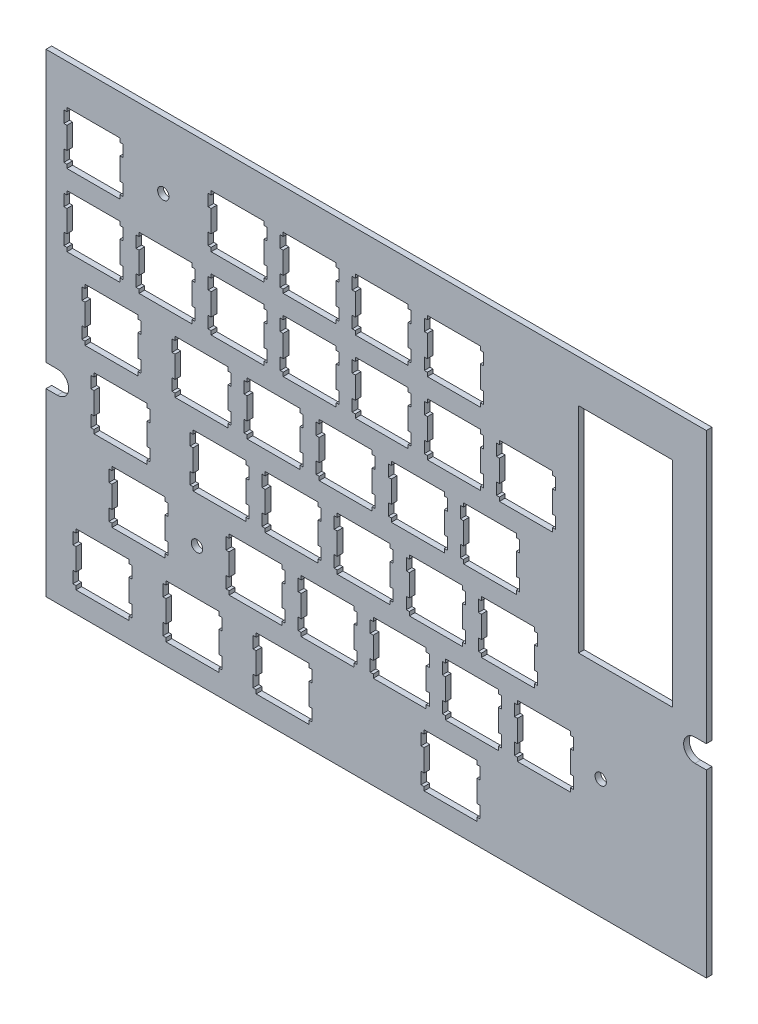
from build123d import *

# Parameters (mm, degrees)
MODEL_R         = 1.5
MODEL_W         = 24.78
MODEL_H         = 56.609226212
EXTRUDE_1_DEPTH = 1.5


with BuildPart() as part:
    # Model → 凸台-拉伸1 (new body)
    with BuildSketch(Plane.XY):
        with BuildLine():
            Line((511.599563197, 91.356049899), (337.097647797, 91.356049899))
            Line((337.097647797, 91.356049899), (337.097647797, 138.982456899))
            Line((337.097647797, 138.982456899), (340.097647797, 138.982456899))
            ThreePointArc((340.097647797, 138.982456899), (343.097647797, 141.982456899), (340.097647797, 144.982456899))
            Line((340.097647797, 144.982456899), (337.097647797, 144.982456899))
            Line((337.097647797, 144.982456899), (337.097647797, 216.656356899))
            Line((337.097647797, 216.656356899), (511.599563197, 216.656356899))
            Line((511.599563197, 216.656356899), (511.599563197, 144.981756899))
            Line((511.599563197, 144.981756899), (508.599563197, 144.981756899))
            ThreePointArc((508.599563197, 144.981756899), (505.599563197, 141.981756899), (508.599563197, 138.981756899))
            Line((508.599563197, 138.981756899), (511.599563197, 138.981756899))
            Line((511.599563197, 138.981756899), (511.599563197, 91.356049899))
        make_face()
        with Locations((368.097647797, 199.131356899)):
            Circle(MODEL_R, mode=Mode.SUBTRACT)
        with Locations((377.006250697, 122.931656899)):
            Circle(MODEL_R, mode=Mode.SUBTRACT)
        with Locations((483.684563197, 122.931656899)):
            Circle(MODEL_R, mode=Mode.SUBTRACT)
        Polygon((392.628563197, 110.882856899), (392.628563197, 109.882456899), (391.827763197, 109.882456899), (391.827763197, 106.783156899), (392.628563197, 106.783156899), (392.628563197, 100.981646899), (391.827763197, 100.981646899), (391.827763197, 97.882466899), (392.628563197, 97.882466899), (392.628563197, 96.881996899), (406.627863197, 96.881996899), (406.627863197, 97.882466899), (407.428663197, 97.882466899), (407.428663197, 100.981646899), (406.627863197, 100.981646899), (406.627863197, 106.783156899), (407.428663197, 106.783156899), (407.428663197, 109.882456899), (406.627863197, 109.882456899), (406.627863197, 110.882856899), align=None, mode=Mode.SUBTRACT)
        Polygon((368.814563197, 110.882856899), (368.814563197, 109.882456899), (368.015363197, 109.882456899), (368.015363197, 106.783156899), (368.814563197, 106.783156899), (368.814563197, 100.981646899), (368.015363197, 100.981646899), (368.015363197, 97.882466899), (368.814563197, 97.882466899), (368.814563197, 96.881996899), (382.815363197, 96.881996899), (382.815363197, 97.882466899), (383.614763197, 97.882466899), (383.614763197, 100.981646899), (382.815363197, 100.981646899), (382.815363197, 106.783156899), (383.614763197, 106.783156899), (383.614763197, 109.882456899), (382.815363197, 109.882456899), (382.815363197, 110.882856899), align=None, mode=Mode.SUBTRACT)
        Polygon((345.003473197, 110.882856899), (345.003473197, 109.882456899), (344.202843197, 109.882456899), (344.202843197, 106.783156899), (345.003473197, 106.783156899), (345.003473197, 100.981646899), (344.202843197, 100.981646899), (344.202843197, 97.882466899), (345.003473197, 97.882466899), (345.003473197, 96.881996899), (359.002963197, 96.881996899), (359.002963197, 97.882466899), (359.803563197, 97.882466899), (359.803563197, 100.981646899), (359.002963197, 100.981646899), (359.002963197, 106.783156899), (359.803563197, 106.783156899), (359.803563197, 109.882456899), (359.002963197, 109.882456899), (359.002963197, 110.882856899), align=None, mode=Mode.SUBTRACT)
        Polygon((461.684563197, 129.931356899), (461.684563197, 128.931056899), (460.883563197, 128.931056899), (460.883563197, 125.833156899), (461.684563197, 125.833156899), (461.684563197, 120.031656899), (460.883563197, 120.031656899), (460.883563197, 116.931056899), (461.684563197, 116.931056899), (461.684563197, 115.931956899), (475.684563197, 115.931956899), (475.684563197, 116.931056899), (476.483563197, 116.931056899), (476.483563197, 120.031656899), (475.684563197, 120.031656899), (475.684563197, 125.833156899), (476.483563197, 125.833156899), (476.483563197, 128.931056899), (475.684563197, 128.931056899), (475.684563197, 129.931356899), align=None, mode=Mode.SUBTRACT)
        Polygon((442.634563197, 129.931356899), (442.634563197, 128.931056899), (441.833563197, 128.931056899), (441.833563197, 125.833156899), (442.634563197, 125.833156899), (442.634563197, 120.031656899), (441.833563197, 120.031656899), (441.833563197, 116.931056899), (442.634563197, 116.931056899), (442.634563197, 115.931956899), (456.634563197, 115.931956899), (456.634563197, 116.931056899), (457.433563197, 116.931056899), (457.433563197, 120.031656899), (456.634563197, 120.031656899), (456.634563197, 125.833156899), (457.433563197, 125.833156899), (457.433563197, 128.931056899), (456.634563197, 128.931056899), (456.634563197, 129.931356899), align=None, mode=Mode.SUBTRACT)
        Polygon((423.584763197, 129.931356899), (423.584763197, 128.931056899), (422.783963197, 128.931056899), (422.783963197, 125.833156899), (423.584763197, 125.833156899), (423.584763197, 120.031656899), (422.783963197, 120.031656899), (422.783963197, 116.931056899), (423.584763197, 116.931056899), (423.584763197, 115.931956899), (437.584063197, 115.931956899), (437.584063197, 116.931056899), (438.383463197, 116.931056899), (438.383463197, 120.031656899), (437.584063197, 120.031656899), (437.584063197, 125.833156899), (438.383463197, 125.833156899), (438.383463197, 128.931056899), (437.584063197, 128.931056899), (437.584063197, 129.931356899), align=None, mode=Mode.SUBTRACT)
        Polygon((404.534763197, 129.931356899), (404.534763197, 128.931056899), (403.733963197, 128.931056899), (403.733963197, 125.833156899), (404.534763197, 125.833156899), (404.534763197, 120.031656899), (403.733963197, 120.031656899), (403.733963197, 116.931056899), (404.534763197, 116.931056899), (404.534763197, 115.931956899), (418.534063197, 115.931956899), (418.534063197, 116.931056899), (419.333463197, 116.931056899), (419.333463197, 120.031656899), (418.534063197, 120.031656899), (418.534063197, 125.833156899), (419.333463197, 125.833156899), (419.333463197, 128.931056899), (418.534063197, 128.931056899), (418.534063197, 129.931356899), align=None, mode=Mode.SUBTRACT)
        Polygon((385.484763197, 129.931356899), (385.484763197, 128.931056899), (384.683963197, 128.931056899), (384.683963197, 125.833156899), (385.484763197, 125.833156899), (385.484763197, 120.031656899), (384.683963197, 120.031656899), (384.683963197, 116.931056899), (385.484763197, 116.931056899), (385.484763197, 115.931956899), (399.484063197, 115.931956899), (399.484063197, 116.931056899), (400.283463197, 116.931056899), (400.283463197, 120.031656899), (399.484063197, 120.031656899), (399.484063197, 125.833156899), (400.283463197, 125.833156899), (400.283463197, 128.931056899), (399.484063197, 128.931056899), (399.484063197, 129.931356899), align=None, mode=Mode.SUBTRACT)
        Polygon((452.159563197, 148.981456899), (452.159563197, 147.980956899), (451.358563197, 147.980956899), (451.358563197, 144.883156899), (452.159563197, 144.883156899), (452.159563197, 139.081756899), (451.358563197, 139.081756899), (451.358563197, 135.981156899), (452.159563197, 135.981156899), (452.159563197, 134.982156899), (466.159563197, 134.982156899), (466.159563197, 135.981156899), (466.958563197, 135.981156899), (466.958563197, 139.081756899), (466.159563197, 139.081756899), (466.159563197, 144.883156899), (466.958563197, 144.883156899), (466.958563197, 147.980956899), (466.159563197, 147.980956899), (466.159563197, 148.981456899), align=None, mode=Mode.SUBTRACT)
        Polygon((433.109763197, 148.981456899), (433.109763197, 147.980956899), (432.308963197, 147.980956899), (432.308963197, 144.883156899), (433.109763197, 144.883156899), (433.109763197, 139.081756899), (432.308963197, 139.081756899), (432.308963197, 135.981156899), (433.109763197, 135.981156899), (433.109763197, 134.982156899), (447.109563197, 134.982156899), (447.109563197, 135.981156899), (447.908563197, 135.981156899), (447.908563197, 139.081756899), (447.109563197, 139.081756899), (447.109563197, 144.883156899), (447.908563197, 144.883156899), (447.908563197, 147.980956899), (447.109563197, 147.980956899), (447.109563197, 148.981456899), align=None, mode=Mode.SUBTRACT)
        Polygon((414.059763197, 148.981456899), (414.059763197, 147.980956899), (413.258963197, 147.980956899), (413.258963197, 144.883156899), (414.059763197, 144.883156899), (414.059763197, 139.081756899), (413.258963197, 139.081756899), (413.258963197, 135.981156899), (414.059763197, 135.981156899), (414.059763197, 134.982156899), (428.059063197, 134.982156899), (428.059063197, 135.981156899), (428.858463197, 135.981156899), (428.858463197, 139.081756899), (428.059063197, 139.081756899), (428.059063197, 144.883156899), (428.858463197, 144.883156899), (428.858463197, 147.980956899), (428.059063197, 147.980956899), (428.059063197, 148.981456899), align=None, mode=Mode.SUBTRACT)
        Polygon((395.009763197, 148.981456899), (395.009763197, 147.980956899), (394.208963197, 147.980956899), (394.208963197, 144.883156899), (395.009763197, 144.883156899), (395.009763197, 139.081756899), (394.208963197, 139.081756899), (394.208963197, 135.981156899), (395.009763197, 135.981156899), (395.009763197, 134.982156899), (409.009063197, 134.982156899), (409.009063197, 135.981156899), (409.808463197, 135.981156899), (409.808463197, 139.081756899), (409.009063197, 139.081756899), (409.009063197, 144.883156899), (409.808463197, 144.883156899), (409.808463197, 147.980956899), (409.009063197, 147.980956899), (409.009063197, 148.981456899), align=None, mode=Mode.SUBTRACT)
        Polygon((375.959763197, 148.981456899), (375.959763197, 147.980956899), (375.159063197, 147.980956899), (375.159063197, 144.883156899), (375.959763197, 144.883156899), (375.959763197, 139.081756899), (375.159063197, 139.081756899), (375.159063197, 135.981156899), (375.959763197, 135.981156899), (375.959763197, 134.982156899), (389.959063197, 134.982156899), (389.959063197, 135.981156899), (390.758463197, 135.981156899), (390.758463197, 139.081756899), (389.959063197, 139.081756899), (389.959063197, 144.883156899), (390.758463197, 144.883156899), (390.758463197, 147.980956899), (389.959063197, 147.980956899), (389.959063197, 148.981456899), align=None, mode=Mode.SUBTRACT)
        Polygon((349.764593197, 148.981456899), (349.764593197, 147.980956899), (348.965343197, 147.980956899), (348.965343197, 144.883156899), (349.764593197, 144.883156899), (349.764593197, 139.081756899), (348.965343197, 139.081756899), (348.965343197, 135.981156899), (349.764593197, 135.981156899), (349.764593197, 134.982156899), (363.765463197, 134.982156899), (363.765463197, 135.981156899), (364.564763197, 135.981156899), (364.564763197, 139.081756899), (363.765463197, 139.081756899), (363.765463197, 144.883156899), (364.564763197, 144.883156899), (364.564763197, 147.980956899), (363.765463197, 147.980956899), (363.765463197, 148.981456899), align=None, mode=Mode.SUBTRACT)
        Polygon((447.397563197, 168.031456899), (447.397563197, 167.030956899), (446.596563197, 167.030956899), (446.596563197, 163.931756899), (447.397563197, 163.931756899), (447.397563197, 158.131756899), (446.596563197, 158.131756899), (446.596563197, 155.031156899), (447.397563197, 155.031156899), (447.397563197, 154.032156899), (461.396563197, 154.032156899), (461.396563197, 155.031156899), (462.197563197, 155.031156899), (462.197563197, 158.131756899), (461.396563197, 158.131756899), (461.396563197, 163.931756899), (462.197563197, 163.931756899), (462.197563197, 167.030956899), (461.396563197, 167.030956899), (461.396563197, 168.031456899), align=None, mode=Mode.SUBTRACT)
        Polygon((428.347263197, 168.031456899), (428.347263197, 167.030956899), (427.546463197, 167.030956899), (427.546463197, 163.931756899), (428.347263197, 163.931756899), (428.347263197, 158.131756899), (427.546463197, 158.131756899), (427.546463197, 155.031156899), (428.347263197, 155.031156899), (428.347263197, 154.032156899), (442.346563197, 154.032156899), (442.346563197, 155.031156899), (443.147563197, 155.031156899), (443.147563197, 158.131756899), (442.346563197, 158.131756899), (442.346563197, 163.931756899), (443.147563197, 163.931756899), (443.147563197, 167.030956899), (442.346563197, 167.030956899), (442.346563197, 168.031456899), align=None, mode=Mode.SUBTRACT)
        Polygon((409.297263197, 168.031456899), (409.297263197, 167.030956899), (408.496463197, 167.030956899), (408.496463197, 163.931756899), (409.297263197, 163.931756899), (409.297263197, 158.131756899), (408.496463197, 158.131756899), (408.496463197, 155.031156899), (409.297263197, 155.031156899), (409.297263197, 154.032156899), (423.296563197, 154.032156899), (423.296563197, 155.031156899), (424.097363197, 155.031156899), (424.097363197, 158.131756899), (423.296563197, 158.131756899), (423.296563197, 163.931756899), (424.097363197, 163.931756899), (424.097363197, 167.030956899), (423.296563197, 167.030956899), (423.296563197, 168.031456899), align=None, mode=Mode.SUBTRACT)
        Polygon((390.247263197, 168.031456899), (390.247263197, 167.030956899), (389.446463197, 167.030956899), (389.446463197, 163.931756899), (390.247263197, 163.931756899), (390.247263197, 158.131756899), (389.446463197, 158.131756899), (389.446463197, 155.031156899), (390.247263197, 155.031156899), (390.247263197, 154.032156899), (404.246563197, 154.032156899), (404.246563197, 155.031156899), (405.047363197, 155.031156899), (405.047363197, 158.131756899), (404.246563197, 158.131756899), (404.246563197, 163.931756899), (405.047363197, 163.931756899), (405.047363197, 167.030956899), (404.246563197, 167.030956899), (404.246563197, 168.031456899), align=None, mode=Mode.SUBTRACT)
        Polygon((371.197263197, 168.031456899), (371.197263197, 167.030956899), (370.396563197, 167.030956899), (370.396563197, 163.931756899), (371.197263197, 163.931756899), (371.197263197, 158.131756899), (370.396563197, 158.131756899), (370.396563197, 155.031156899), (371.197263197, 155.031156899), (371.197263197, 154.032156899), (385.196563197, 154.032156899), (385.196563197, 155.031156899), (385.997363197, 155.031156899), (385.997363197, 158.131756899), (385.196563197, 158.131756899), (385.196563197, 163.931756899), (385.997363197, 163.931756899), (385.997363197, 167.030956899), (385.196563197, 167.030956899), (385.196563197, 168.031456899), align=None, mode=Mode.SUBTRACT)
        Polygon((347.384723197, 168.031456899), (347.384723197, 167.030956899), (346.584093197, 167.030956899), (346.584093197, 163.931756899), (347.384723197, 163.931756899), (347.384723197, 158.131756899), (346.584093197, 158.131756899), (346.584093197, 155.031156899), (347.384723197, 155.031156899), (347.384723197, 154.032156899), (361.384263197, 154.032156899), (361.384263197, 155.031156899), (362.183463197, 155.031156899), (362.183463197, 158.131756899), (361.384263197, 158.131756899), (361.384263197, 163.931756899), (362.183463197, 163.931756899), (362.183463197, 167.030956899), (361.384263197, 167.030956899), (361.384263197, 168.031456899), align=None, mode=Mode.SUBTRACT)
        Polygon((456.920563197, 187.081456899), (456.920563197, 186.080956899), (456.121563197, 186.080956899), (456.121563197, 182.981756899), (456.920563197, 182.981756899), (456.920563197, 177.181756899), (456.121563197, 177.181756899), (456.121563197, 174.081156899), (456.920563197, 174.081156899), (456.920563197, 173.082156899), (470.921563197, 173.082156899), (470.921563197, 174.081156899), (471.722563197, 174.081156899), (471.722563197, 177.181756899), (470.921563197, 177.181756899), (470.921563197, 182.981756899), (471.722563197, 182.981756899), (471.722563197, 186.080956899), (470.921563197, 186.080956899), (470.921563197, 187.081456899), align=None, mode=Mode.SUBTRACT)
        Polygon((437.870863197, 187.081456899), (437.870863197, 186.080956899), (437.071463197, 186.080956899), (437.071463197, 182.981756899), (437.870863197, 182.981756899), (437.870863197, 177.181756899), (437.071463197, 177.181756899), (437.071463197, 174.081156899), (437.870863197, 174.081156899), (437.870863197, 173.082156899), (451.871563197, 173.082156899), (451.871563197, 174.081156899), (452.670563197, 174.081156899), (452.670563197, 177.181756899), (451.871563197, 177.181756899), (451.871563197, 182.981756899), (452.670563197, 182.981756899), (452.670563197, 186.080956899), (451.871563197, 186.080956899), (451.871563197, 187.081456899), align=None, mode=Mode.SUBTRACT)
        Polygon((418.822263197, 187.081456899), (418.822263197, 186.080956899), (418.021463197, 186.080956899), (418.021463197, 182.981756899), (418.822263197, 182.981756899), (418.822263197, 177.181756899), (418.021463197, 177.181756899), (418.021463197, 174.081156899), (418.822263197, 174.081156899), (418.822263197, 173.082156899), (432.821563197, 173.082156899), (432.821563197, 174.081156899), (433.620963197, 174.081156899), (433.620963197, 177.181756899), (432.821563197, 177.181756899), (432.821563197, 182.981756899), (433.620963197, 182.981756899), (433.620963197, 186.080956899), (432.821563197, 186.080956899), (432.821563197, 187.081456899), align=None, mode=Mode.SUBTRACT)
        Polygon((399.772263197, 187.081456899), (399.772263197, 186.080956899), (398.971463197, 186.080956899), (398.971463197, 182.981756899), (399.772263197, 182.981756899), (399.772263197, 177.181756899), (398.971463197, 177.181756899), (398.971463197, 174.081156899), (399.772263197, 174.081156899), (399.772263197, 173.082156899), (413.771563197, 173.082156899), (413.771563197, 174.081156899), (414.572363197, 174.081156899), (414.572363197, 177.181756899), (413.771563197, 177.181756899), (413.771563197, 182.981756899), (414.572363197, 182.981756899), (414.572363197, 186.080956899), (413.771563197, 186.080956899), (413.771563197, 187.081456899), align=None, mode=Mode.SUBTRACT)
        Polygon((380.722263197, 187.081456899), (380.722263197, 186.080956899), (379.921463197, 186.080956899), (379.921463197, 182.981756899), (380.722263197, 182.981756899), (380.722263197, 177.181756899), (379.921463197, 177.181756899), (379.921463197, 174.081156899), (380.722263197, 174.081156899), (380.722263197, 173.082156899), (394.721563197, 173.082156899), (394.721563197, 174.081156899), (395.522363197, 174.081156899), (395.522363197, 177.181756899), (394.721563197, 177.181756899), (394.721563197, 182.981756899), (395.522363197, 182.981756899), (395.522363197, 186.080956899), (394.721563197, 186.080956899), (394.721563197, 187.081456899), align=None, mode=Mode.SUBTRACT)
        Polygon((361.672263197, 187.081456899), (361.672263197, 186.080956899), (360.871563197, 186.080956899), (360.871563197, 182.981756899), (361.672263197, 182.981756899), (361.672263197, 177.181756899), (360.871563197, 177.181756899), (360.871563197, 174.081156899), (361.672263197, 174.081156899), (361.672263197, 173.082156899), (375.671563197, 173.082156899), (375.671563197, 174.081156899), (376.472363197, 174.081156899), (376.472363197, 177.181756899), (375.671563197, 177.181756899), (375.671563197, 182.981756899), (376.472363197, 182.981756899), (376.472363197, 186.080956899), (375.671563197, 186.080956899), (375.671563197, 187.081456899), align=None, mode=Mode.SUBTRACT)
        Polygon((342.622213197, 187.081456899), (342.622213197, 186.080956899), (341.821573197, 186.080956899), (341.821573197, 182.981756899), (342.622213197, 182.981756899), (342.622213197, 177.181756899), (341.821573197, 177.181756899), (341.821573197, 174.081156899), (342.622213197, 174.081156899), (342.622213197, 173.082156899), (356.621763197, 173.082156899), (356.621763197, 174.081156899), (357.422363197, 174.081156899), (357.422363197, 177.181756899), (356.621763197, 177.181756899), (356.621763197, 182.981756899), (357.422363197, 182.981756899), (357.422363197, 186.080956899), (356.621763197, 186.080956899), (356.621763197, 187.081456899), align=None, mode=Mode.SUBTRACT)
        Polygon((437.870863197, 206.131356899), (437.870863197, 205.131356899), (437.071463197, 205.131356899), (437.071463197, 202.031356899), (437.870863197, 202.031356899), (437.870863197, 196.231356899), (437.071463197, 196.231356899), (437.071463197, 193.131156899), (437.870863197, 193.131156899), (437.870863197, 192.132156899), (451.871563197, 192.132156899), (451.871563197, 193.131156899), (452.670563197, 193.131156899), (452.670563197, 196.231356899), (451.871563197, 196.231356899), (451.871563197, 202.031356899), (452.670563197, 202.031356899), (452.670563197, 205.131356899), (451.871563197, 205.131356899), (451.871563197, 206.131356899), align=None, mode=Mode.SUBTRACT)
        Polygon((418.822263197, 206.131356899), (418.822263197, 205.131356899), (418.021463197, 205.131356899), (418.021463197, 202.031356899), (418.822263197, 202.031356899), (418.822263197, 196.231356899), (418.021463197, 196.231356899), (418.021463197, 193.131156899), (418.822263197, 193.131156899), (418.822263197, 192.132156899), (432.821563197, 192.132156899), (432.821563197, 193.131156899), (433.620963197, 193.131156899), (433.620963197, 196.231356899), (432.821563197, 196.231356899), (432.821563197, 202.031356899), (433.620963197, 202.031356899), (433.620963197, 205.131356899), (432.821563197, 205.131356899), (432.821563197, 206.131356899), align=None, mode=Mode.SUBTRACT)
        Polygon((399.772263197, 206.131356899), (399.772263197, 205.131356899), (398.971463197, 205.131356899), (398.971463197, 202.031356899), (399.772263197, 202.031356899), (399.772263197, 196.231356899), (398.971463197, 196.231356899), (398.971463197, 193.131156899), (399.772263197, 193.131156899), (399.772263197, 192.132156899), (413.771563197, 192.132156899), (413.771563197, 193.131156899), (414.572363197, 193.131156899), (414.572363197, 196.231356899), (413.771563197, 196.231356899), (413.771563197, 202.031356899), (414.572363197, 202.031356899), (414.572363197, 205.131356899), (413.771563197, 205.131356899), (413.771563197, 206.131356899), align=None, mode=Mode.SUBTRACT)
        Polygon((380.722263197, 206.131356899), (380.722263197, 205.131356899), (379.921463197, 205.131356899), (379.921463197, 202.031356899), (380.722263197, 202.031356899), (380.722263197, 196.231356899), (379.921463197, 196.231356899), (379.921463197, 193.131156899), (380.722263197, 193.131156899), (380.722263197, 192.132156899), (394.721563197, 192.132156899), (394.721563197, 193.131156899), (395.522363197, 193.131156899), (395.522363197, 196.231356899), (394.721563197, 196.231356899), (394.721563197, 202.031356899), (395.522363197, 202.031356899), (395.522363197, 205.131356899), (394.721563197, 205.131356899), (394.721563197, 206.131356899), align=None, mode=Mode.SUBTRACT)
        Polygon((342.622213197, 206.131356899), (342.622213197, 205.131356899), (341.821573197, 205.131356899), (341.821573197, 202.031356899), (342.622213197, 202.031356899), (342.622213197, 196.231356899), (341.821573197, 196.231356899), (341.821573197, 193.131156899), (342.622213197, 193.131156899), (342.622213197, 192.132156899), (356.621763197, 192.132156899), (356.621763197, 193.131156899), (357.422363197, 193.131156899), (357.422363197, 196.231356899), (356.621763197, 196.231356899), (356.621763197, 202.031356899), (357.422363197, 202.031356899), (357.422363197, 205.131356899), (356.621763197, 205.131356899), (356.621763197, 206.131356899), align=None, mode=Mode.SUBTRACT)
        with Locations((490.209563197, 177.150970005)):
            Rectangle(MODEL_W, MODEL_H, mode=Mode.SUBTRACT)
        Polygon((354.527188197, 129.932111899), (354.527188197, 128.931711899), (353.727988197, 128.931711899), (353.727988197, 125.832411899), (354.527188197, 125.832411899), (354.527188197, 120.030901899), (353.727988197, 120.030901899), (353.727988197, 116.931721899), (354.527188197, 116.931721899), (354.527188197, 115.931251899), (368.527988197, 115.931251899), (368.527988197, 116.931721899), (369.327388197, 116.931721899), (369.327388197, 120.030901899), (368.527988197, 120.030901899), (368.527988197, 125.832411899), (369.327388197, 125.832411899), (369.327388197, 128.931711899), (368.527988197, 128.931711899), (368.527988197, 129.932111899), align=None, mode=Mode.SUBTRACT)
        Polygon((437.009013197, 110.882426899), (437.009013197, 109.882126899), (436.208013197, 109.882126899), (436.208013197, 106.784226899), (437.009013197, 106.784226899), (437.009013197, 100.982726899), (436.208013197, 100.982726899), (436.208013197, 97.882126899), (437.009013197, 97.882126899), (437.009013197, 96.883026899), (451.009013197, 96.883026899), (451.009013197, 97.882126899), (451.808013197, 97.882126899), (451.808013197, 100.982726899), (451.009013197, 100.982726899), (451.009013197, 106.784226899), (451.808013197, 106.784226899), (451.808013197, 109.882126899), (451.009013197, 109.882126899), (451.009013197, 110.882426899), align=None, mode=Mode.SUBTRACT)
    extrude(amount=EXTRUDE_1_DEPTH)


solid = part.part
